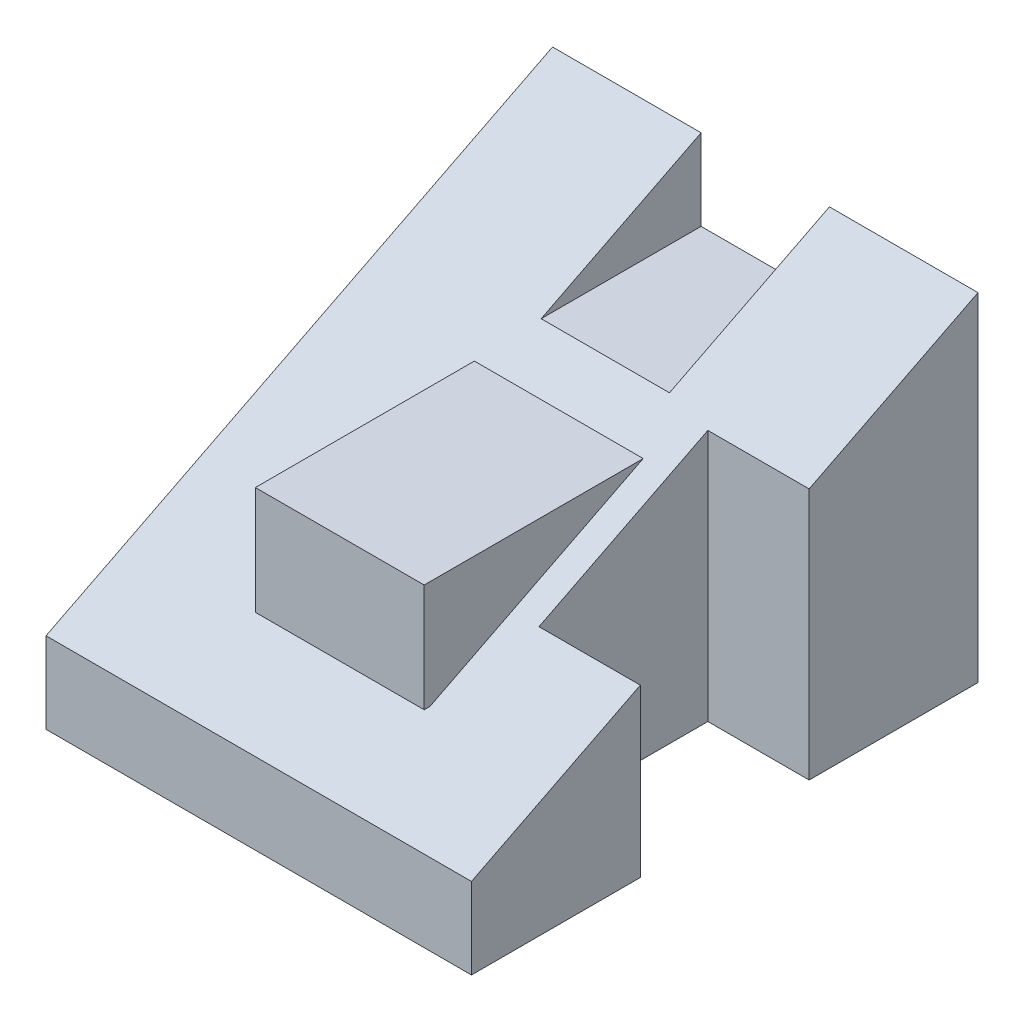
from build123d import *

# Parameters (mm, degrees)
BOSS_EXTRUDE1_DEPTH = 63
CUT_EXTRUDE1_DEPTH  = 15
CUT_EXTRUDE2_REACH  = 111.973
SKETCH3_W           = 19
SKETCH3_H           = 12
BOSS_EXTRUDE2_REACH = 123.973
BOSS_EXTRUDE2_START = -12
SKETCH4_W           = 25
SKETCH4_H           = 16


with BuildPart() as part:
    # Sketch1 → Boss-Extrude1 (new body)
    with BuildSketch(Plane(origin=(0, 0, 0), x_dir=(0, 0, -1), z_dir=(1, 0, 0))):
        Polygon((0, 0), (75, 0), (75, 50), (0, 12), align=None)
    extrude(amount=-BOSS_EXTRUDE1_DEPTH)

    # Sketch2 → Cut-Extrude1 (cut)
    with BuildSketch(Plane(origin=(0, 0, 0), x_dir=(0, 0, -1), z_dir=(1, 0, 0))):
        Polygon((25, 24.666666667), (25, 0), (50, 0), (50, 37.333333333), align=None)
    extrude(amount=-CUT_EXTRUDE1_DEPTH, mode=Mode.SUBTRACT)

    # Sketch3 → Cut-Extrude2 (cut, up to next)
    with BuildSketch(Plane(origin=(0, 0, -75), x_dir=(-1, 0, 0), z_dir=(0, 0, -1)), mode=Mode.PRIVATE) as cut_extrude2_sk1:
        with Locations((31.5, 44)):
            Rectangle(SKETCH3_W, SKETCH3_H)
    cut_extrude2_tool1 = extrude(cut_extrude2_sk1.sketch, amount=-CUT_EXTRUDE2_REACH, mode=Mode.PRIVATE) & part.part
    add(cut_extrude2_tool1.solids().sort_by_distance((-31.5, 44, -75))[0], mode=Mode.SUBTRACT)

    # Boss-Extrude2: up to this plane
    boss_extrude2_end = Plane(origin=(-63, 50, -75), z_dir=(0, 0.8920357760302685, 0.4519647931886695))
    # Sketch4 → Boss-Extrude2 (add, up to the surface)
    with BuildSketch(Plane.XY.offset(BOSS_EXTRUDE2_START), mode=Mode.PRIVATE) as boss_extrude2_sk1:
        with Locations((-31.5, 26.510404023)):
            Rectangle(SKETCH4_W, SKETCH4_H)
    boss_extrude2_tool1 = split(extrude(boss_extrude2_sk1.sketch, amount=-BOSS_EXTRUDE2_REACH, mode=Mode.PRIVATE), bisect_by=boss_extrude2_end, keep=Keep.BOTH, mode=Mode.PRIVATE)
    add(boss_extrude2_tool1.solids().sort_by_distance((-31.5, 26.510404, -12))[0])


solid = part.part
